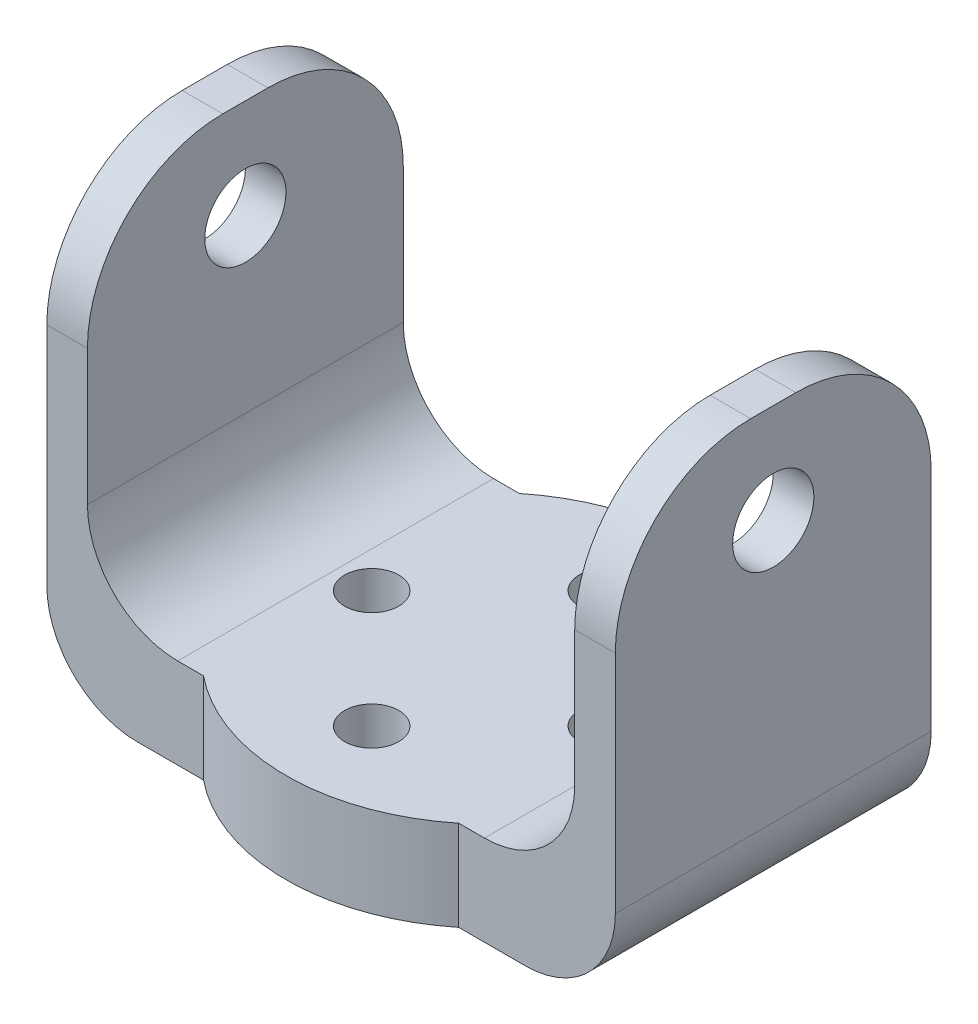
from build123d import *

# Parameters (mm, degrees)
BOSS_EXTRUDE1_DEPTH = 17.5
FILLET3_R           = 10
SKETCH2_R           = 22.5
BOSS_EXTRUDE4_DEPTH = 10
SKETCH4_R           = 3
CUT_EXTRUDE2_DEPTH  = 10
FILLET6_R           = 15
SKETCH6_R           = 4.5
CUT_EXTRUDE3_DEPTH  = 84.517962215


with BuildPart() as part:
    # Sketch1 → Boss-Extrude1 (new, symmetric)
    with BuildSketch(Plane.XY):
        Polygon((-31.5, 0), (31.5, 0), (31.5, 50), (27, 50), (27, 10), (-27, 10), (-27, 50), (-31.5, 50), align=None)
    extrude(amount=BOSS_EXTRUDE1_DEPTH, both=True)

    # Fillet3
    fillet3_edges = [part.edges().sort_by_distance(p)[0] for p in [
        (-27, 10, 0),
        (27, 10, 0),
        (31.5, 0, 0),
        (-31.5, 0, 0),
    ]]
    fillet(fillet3_edges, radius=FILLET3_R)

    # Sketch2 → Boss-Extrude4 (add)
    with BuildSketch(Plane.XZ):
        Circle(SKETCH2_R)
    extrude(amount=-BOSS_EXTRUDE4_DEPTH)

    # Sketch4 → Cut-Extrude2 (cut)
    with BuildSketch(Plane.XZ):
        with Locations((0, 13)):
            Circle(SKETCH4_R)
        with Locations((13, 0)):
            Circle(SKETCH4_R)
        with Locations((0, -13)):
            Circle(SKETCH4_R)
        with Locations((-13, 0)):
            Circle(SKETCH4_R)
    extrude(amount=-CUT_EXTRUDE2_DEPTH, mode=Mode.SUBTRACT)

    # Fillet6
    fillet6_edges = [part.edges().sort_by_distance(p)[0] for p in [
        (29.25, 50, 17.5),
        (29.25, 50, -17.5),
        (-29.25, 50, -17.5),
        (-29.25, 50, 17.5),
    ]]
    fillet(fillet6_edges, radius=FILLET6_R)

    # Sketch6 → Cut-Extrude3 (cut, through all)
    with BuildSketch(Plane(origin=(31.5, 0, 0), x_dir=(0, 0, -1), z_dir=(1, 0, 0))):
        with Locations(Location((0, 39, 0), (0, 0, 90))):
            Circle(SKETCH6_R)
    extrude(amount=-CUT_EXTRUDE3_DEPTH, mode=Mode.SUBTRACT)


solid = part.part
